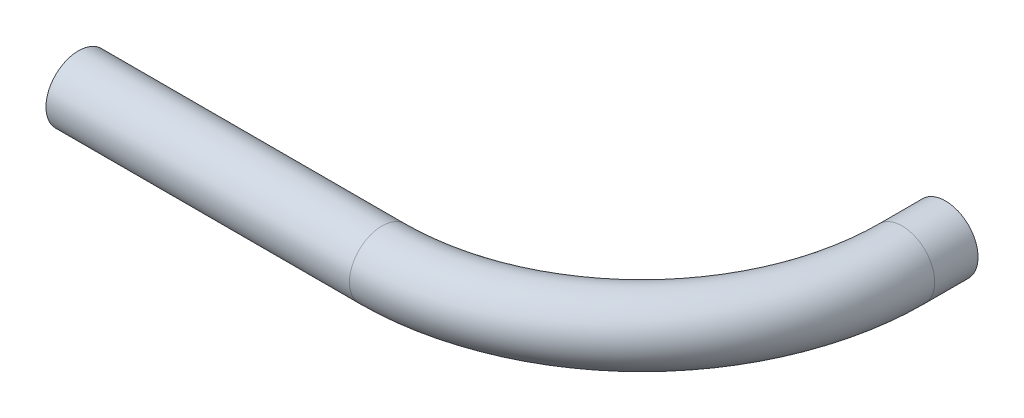
from build123d import *

# Parameters (mm, degrees)
SKETCH2_R   = 19.05
SKETCH2_R_2 = 17.399


with BuildPart() as part:
    # Sweep1: sweep along a path in Sketch1
    with BuildLine(Plane(origin=(0, 0, 0), x_dir=(1, 0, 0), z_dir=(0, 1, 0))) as sweep1_path:
        Line((0, 0), (177.8, 0))
        ThreePointArc((177.8, 0), (285.563073453, 44.636926547), (330.2, 152.4))
        Line((330.2, 152.4), (330.2, 177.8))
    # Sketch2 → Sweep1 (sweep)
    with BuildSketch(Plane(origin=(0, 0, 0), x_dir=(0, 0, -1), z_dir=(1, 0, 0))):
        Circle(SKETCH2_R)
        Circle(SKETCH2_R_2, mode=Mode.SUBTRACT)
    sweep(path=sweep1_path.line)


solid = part.part
